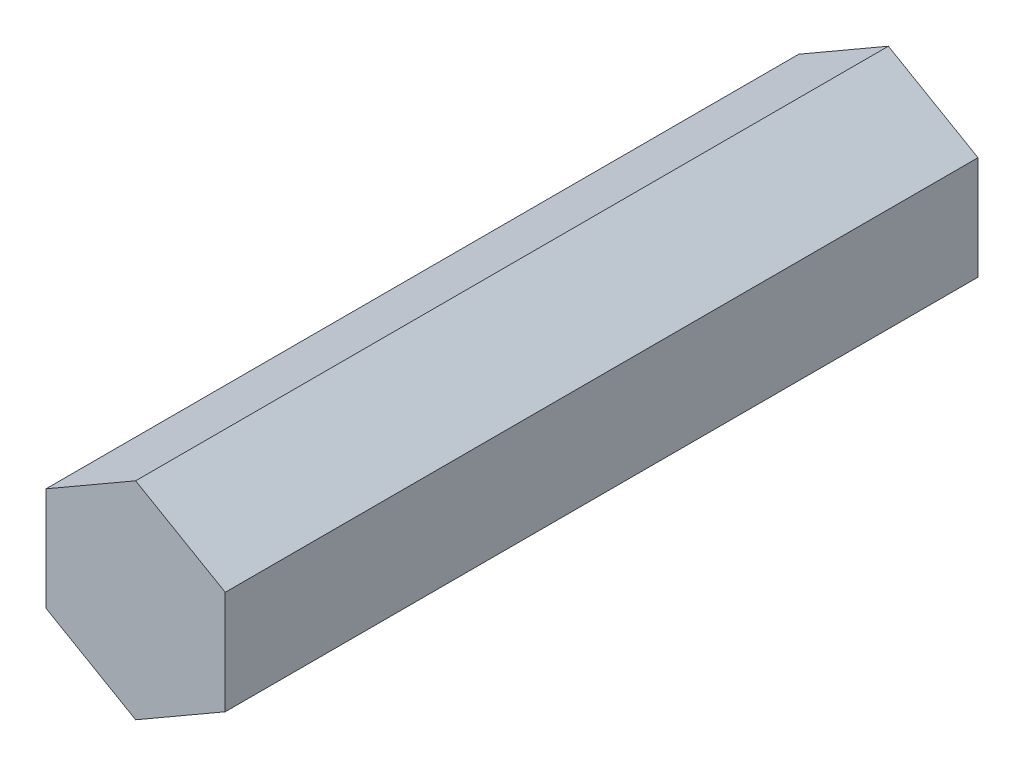
from build123d import *

# Parameters (mm, degrees)
BOSS_EXTRUDE1_DEPTH = 20


with BuildPart() as part:
    # Sketch1 → Boss-Extrude1 (new, symmetric)
    with BuildSketch(Plane.XY):
        Polygon((4.7625, 2.749630657), (0, 5.499261314), (-4.7625, 2.749630657), (-4.7625, -2.749630657), (0, -5.499261314), (4.7625, -2.749630657), align=None)
    extrude(amount=BOSS_EXTRUDE1_DEPTH, both=True)


solid = part.part
